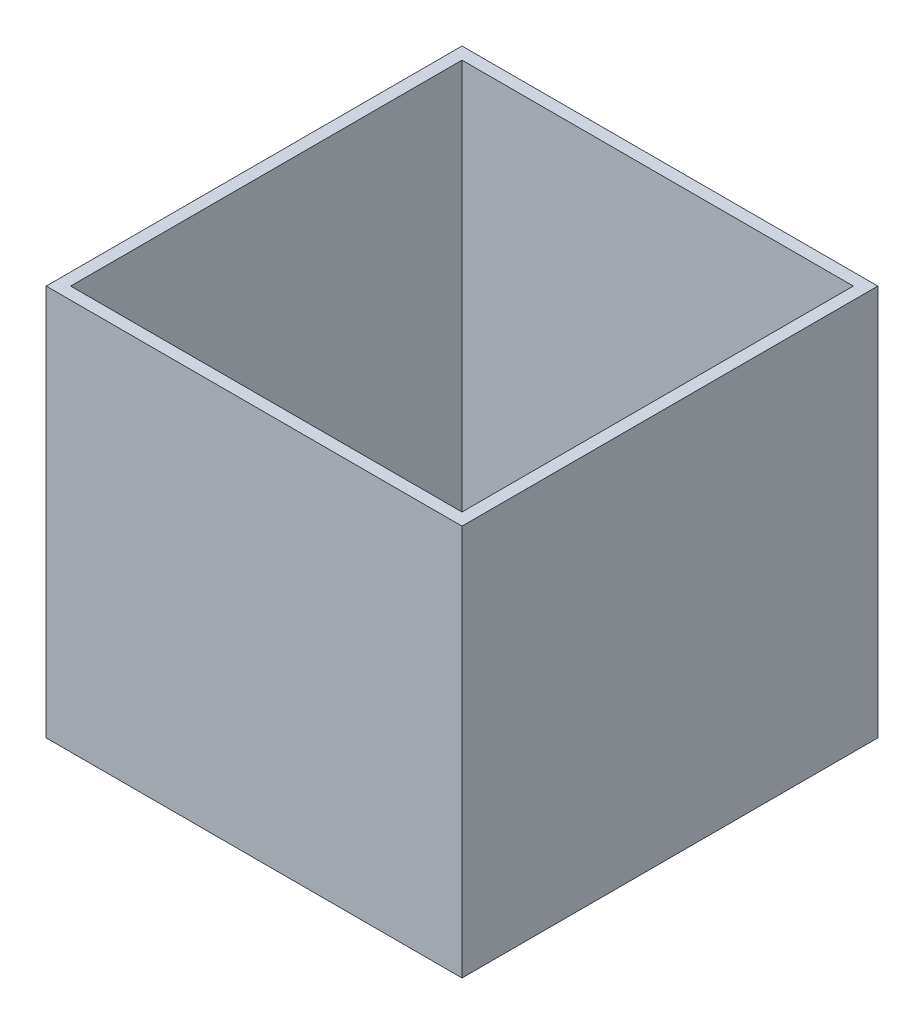
from build123d import *

# Parameters (mm, degrees)
SKETCH1_W           = 215.9
SKETCH1_H           = 215.9
SKETCH1_W_2         = 203.2
SKETCH1_H_2         = 203.2
BOSS_EXTRUDE1_DEPTH = 203.2


with BuildPart() as part:
    # Sketch1 → Boss-Extrude1 (new body)
    with BuildSketch(Plane(origin=(0, 0, 0), x_dir=(1, 0, 0), z_dir=(0, 1, 0))):
        Rectangle(SKETCH1_W, SKETCH1_H)
        Rectangle(SKETCH1_W_2, SKETCH1_H_2, mode=Mode.SUBTRACT)
    extrude(amount=BOSS_EXTRUDE1_DEPTH)


solid = part.part
